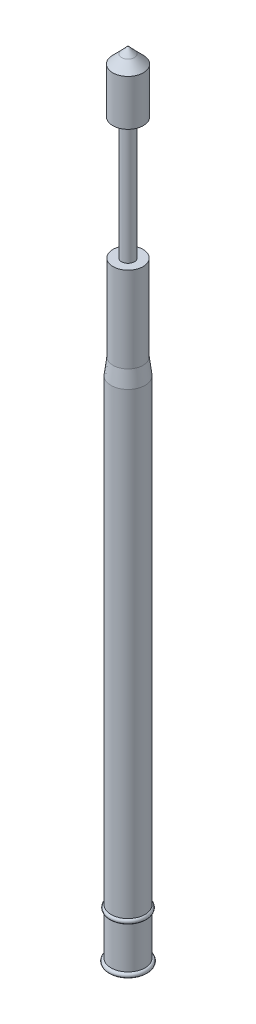
from build123d import *

# Parameters (mm, degrees)
SKETCH_1_R      = 0.835
EXTRUDE_1_DEPTH = 25
SKETCH_2_R      = 0.735
EXTRUDE_2_DEPTH = 5
SKETCH_3_R      = 0.32
EXTRUDE_3_DEPTH = 9


with BuildPart() as part:
    # 草图1 → 凸台-拉伸1 (new body)
    with BuildSketch(Plane(origin=(0, 0, 0), x_dir=(1, 0, 0), z_dir=(0, 1, 0))):
        with Locations(Location((0, 0, 0), (0, 0, 270))):
            Circle(SKETCH_1_R)
    extrude(amount=EXTRUDE_1_DEPTH)

    # 草图2 → 凸台-拉伸2 (add)
    with BuildSketch(Plane(origin=(0, 25, 0), x_dir=(1, 0, 0), z_dir=(0, 1, 0))):
        with Locations(Location((0, 0, 0), (0, 0, 270))):
            Circle(SKETCH_2_R)
    extrude(amount=EXTRUDE_2_DEPTH)

    # 草图3 → 凸台-拉伸3 (add)
    with BuildSketch(Plane(origin=(0, 30, 0), x_dir=(1, 0, 0), z_dir=(0, 1, 0))):
        with Locations(Location((0, 0, 0), (0, 0, 270))):
            Circle(SKETCH_3_R)
    extrude(amount=EXTRUDE_3_DEPTH)

    # 草图5 → 旋转1 (revolve)
    with BuildSketch(Plane.XY, mode=Mode.PRIVATE) as revolve_1_sk:
        Polygon((0.835, 25), (0.735, 25.8), (0.735, 25), align=None)
        with BuildLine():
            Line((0.835, 0.23), (0.835, 0))
            ThreePointArc((0.835, 0), (0.95, 0.115), (0.835, 0.23))
        make_face()
        with BuildLine():
            Line((0.835, 2.5), (0.835, 2.27))
            ThreePointArc((0.835, 2.27), (0.915, 2.385), (0.835, 2.5))
        make_face()
    revolve(revolve_1_sk.sketch.rotate(Axis((0, 0, 0), (0, 1, 0)), 90), axis=Axis((0, 0, 0), (0, 1, 0)))

    # 草图6 → 旋转2 (revolve)
    with BuildSketch(Plane.XY, mode=Mode.PRIVATE) as revolve_2_sk:
        Polygon((0, 39), (-0.75, 38.25), (-0.75, 36), (0, 36), align=None)
    revolve(revolve_2_sk.sketch.rotate(Axis((0, 0, 0), (0, -1, 0)), 90), axis=Axis((0, 0, 0), (0, -1, 0)))

    # 草图7 → 切除-旋转5 (revolve, cut)
    with BuildSketch(Plane.XY, mode=Mode.PRIVATE) as cut_revolve_5_sk:
        Polygon((0.32, 39), (0.02, 39), (0.32, 38.68), align=None)
    revolve(cut_revolve_5_sk.sketch.rotate(Axis((0, 0, 0), (0, -1, 0)), 270), axis=Axis((0, 0, 0), (0, -1, 0)), mode=Mode.SUBTRACT)


solid = part.part
